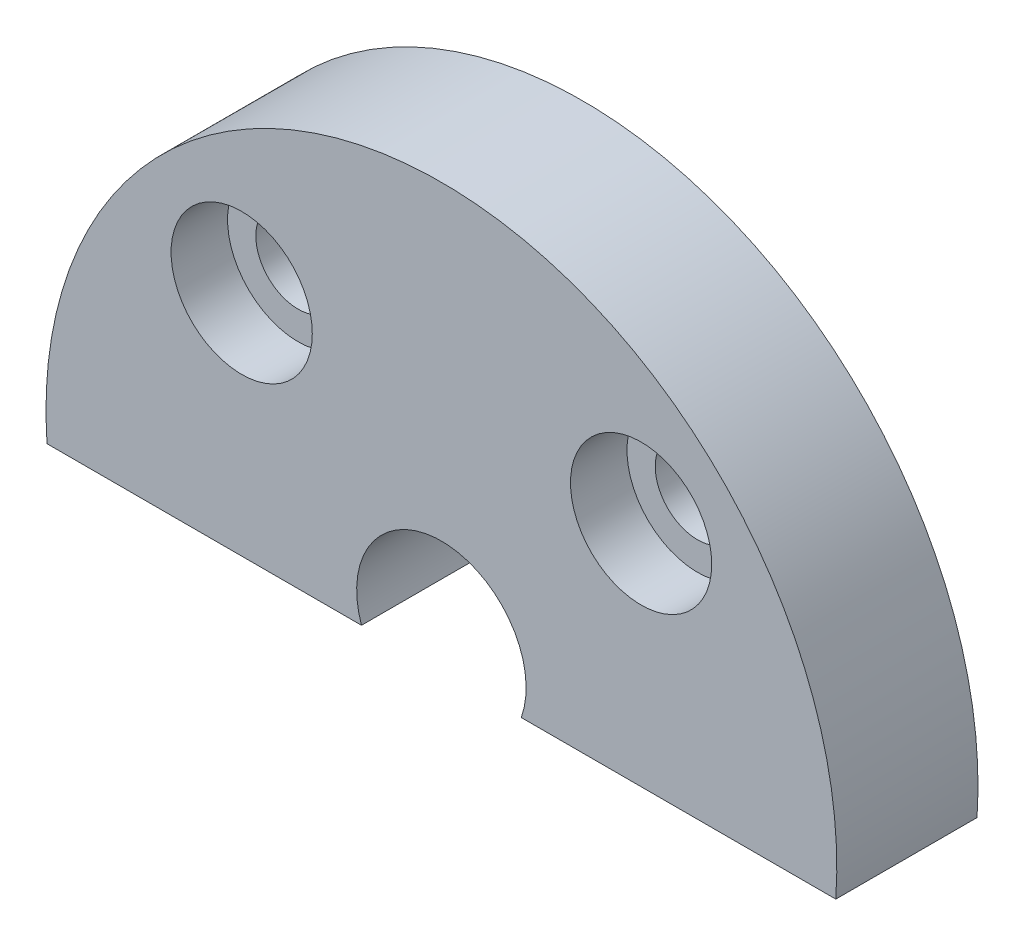
from build123d import *

# Parameters (mm, degrees)
ESQUISSE1_R      = 1.5
EXTRUSION1_DEPTH = 5
ESQUISSE2_R      = 2.5
EXTRUSION2_DEPTH = 2


with BuildPart() as part:
    # Esquisse1 → Extrusion1 (new body)
    with BuildSketch(Plane.XY):
        with BuildLine():
            Line((-13.964240044, -1), (-2.828427125, -1))
            ThreePointArc((-2.828427125, -1), (0, 3), (2.828427125, -1))
            Line((2.828427125, -1), (13.964240044, -1))
            ThreePointArc((13.964240044, -1), (0, 14), (-13.964240044, -1))
        make_face()
        with Locations((-7.071067812, 7.071067812)):
            Circle(ESQUISSE1_R, mode=Mode.SUBTRACT)
        with Locations((7.071067812, 7.071067812)):
            Circle(ESQUISSE1_R, mode=Mode.SUBTRACT)
    extrude(amount=EXTRUSION1_DEPTH)

    # Esquisse2 → Extrusion2 (cut)
    with BuildSketch(Plane.XY.offset(5)):
        with Locations((-7.071067812, 7.071067812)):
            Circle(ESQUISSE2_R)
        with Locations((7.071067812, 7.071067812)):
            Circle(ESQUISSE2_R)
    extrude(amount=-EXTRUSION2_DEPTH, mode=Mode.SUBTRACT)


solid = part.part
